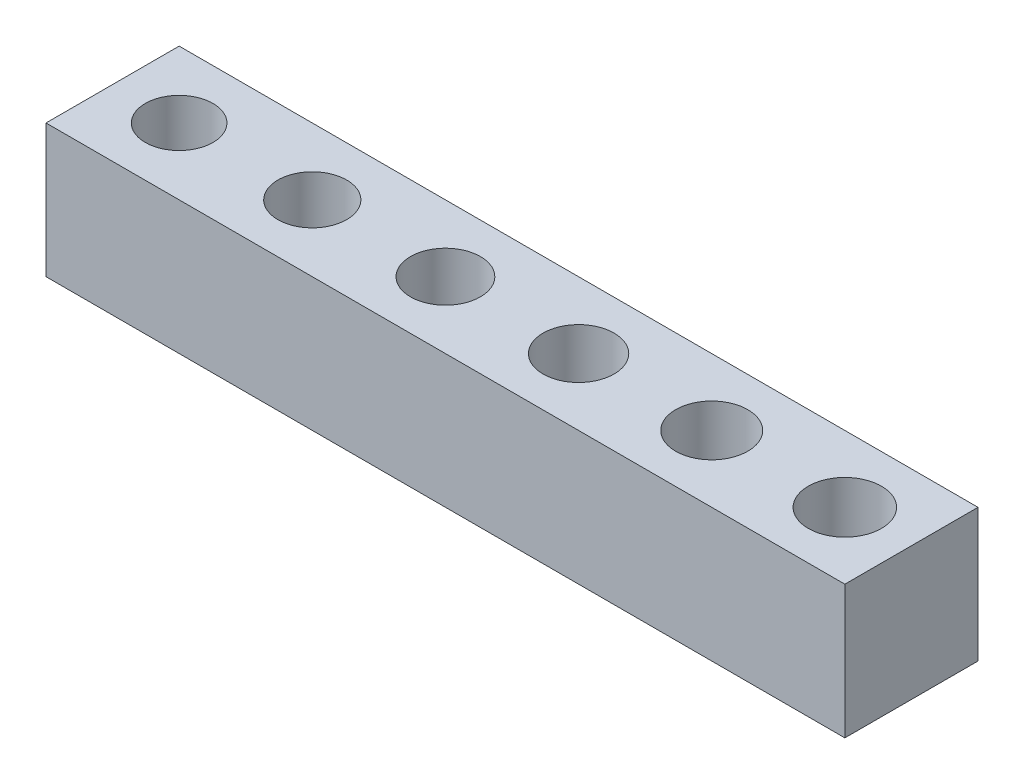
from build123d import *

# Parameters (mm, degrees)
SKETCH1_W           = 12
SKETCH1_H           = 12
SKETCH1_R           = 2.475
BOSS_EXTRUDE1_DEPTH = 12
LPATTERN1_COUNT     = 5
LPATTERN1_PITCH     = 12
LPATTERN1_COL_COUNT = 2
LPATTERN1_COL_PITCH = 12
SKETCH2_R           = 3.05
SKETCH2_R_2         = 3.1
SKETCH2_R_3         = 3.15
SKETCH2_R_4         = 3.2
SKETCH2_R_5         = 3.25
SKETCH2_R_6         = 3.3
CUT_EXTRUDE1_DEPTH  = 5.75


with BuildPart() as part:
    # Sketch1 → Boss-Extrude1 (new body)
    with BuildSketch(Plane(origin=(0, 0, 0), x_dir=(1, 0, 0), z_dir=(0, 1, 0))):
        with Locations((6, 6)):
            Rectangle(SKETCH1_W, SKETCH1_H)
        with Locations(Location((6, 6, 0), (0, 0, 270))):
            Circle(SKETCH1_R, mode=Mode.SUBTRACT)
    boss_extrude1 = extrude(amount=BOSS_EXTRUDE1_DEPTH)

    # LPattern1: Boss-Extrude1 ×5
    with Locations(*[(-i * LPATTERN1_PITCH, 0, 0) for i in range(1, LPATTERN1_COUNT)]):
        add(boss_extrude1)


with BuildPart() as lpattern1_col_1:
    # LPattern1 col: Boss-Extrude1 ×2
    with Locations(*[(i * LPATTERN1_COL_PITCH, 0, 0) for i in range(1, LPATTERN1_COL_COUNT)]):
        add(boss_extrude1)


with BuildPart() as part_1:
    add(part.part)

    # LPattern1 col united with what the copie: union LPattern1 col_1
    add(lpattern1_col_1.part)

    # Sketch2 → Cut-Extrude1 (cut)
    with BuildSketch(Plane(origin=(0, 12, 0), x_dir=(1, 0, 0), z_dir=(0, 1, 0))):
        with Locations(Location((-42, 6, 0), (0, 0, 270))):
            Circle(SKETCH2_R)
        with Locations(Location((-30, 6, 0), (0, 0, 270))):
            Circle(SKETCH2_R_2)
        with Locations(Location((-18, 6, 0), (0, 0, 270))):
            Circle(SKETCH2_R_3)
        with Locations(Location((-6, 6, 0), (0, 0, 270))):
            Circle(SKETCH2_R_4)
        with Locations(Location((6, 6, 0), (0, 0, 270))):
            Circle(SKETCH2_R_5)
        with Locations(Location((18, 6, 0), (0, 0, 270))):
            Circle(SKETCH2_R_6)
    extrude(amount=-CUT_EXTRUDE1_DEPTH, mode=Mode.SUBTRACT)


solid = part_1.part
